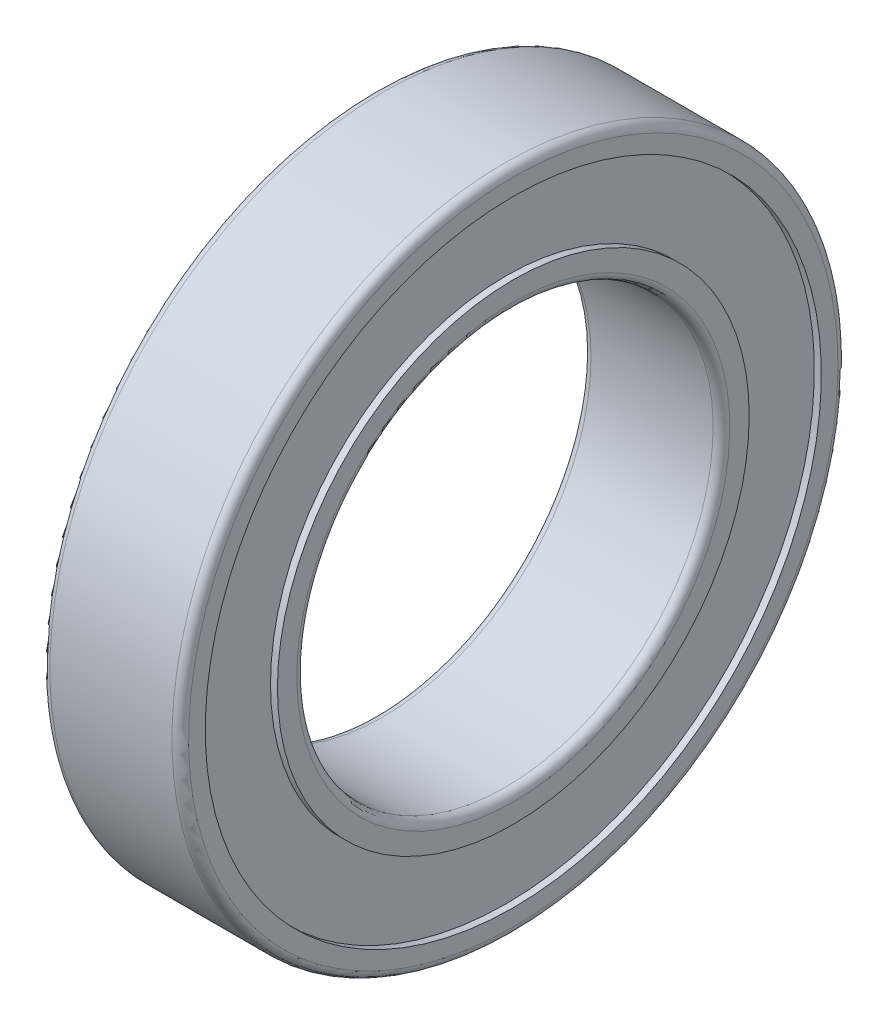
from build123d import *

# Parameters (mm, degrees)
FILLET1_R = 0.3


with BuildPart() as part:
    # Sketch1 → Revolve1 (revolve)
    with BuildSketch(Plane.XY, mode=Mode.PRIVATE) as revolve1_sk:
        Polygon((0, 7.5), (0, 8.5), (0.25, 8.5), (0.25, 11.1), (0, 11.1), (0, 12), (5, 12), (5, 11.1), (4.75, 11.1), (4.75, 8.5), (5, 8.5), (5, 7.5), align=None)
    revolve(revolve1_sk.sketch.rotate(Axis((0, 0, 0), (1, 0, 0)), 180), axis=Axis((0, 0, 0), (1, 0, 0)))

    # Fillet1
    fillet1_edges = [part.edges().sort_by_distance(p)[0] for p in [
        (5, 12, 0),
        (0, 12, 0),
        (0, 7.5, 0),
        (5, 7.5, 0),
    ]]
    fillet(fillet1_edges, radius=FILLET1_R)


solid = part.part
